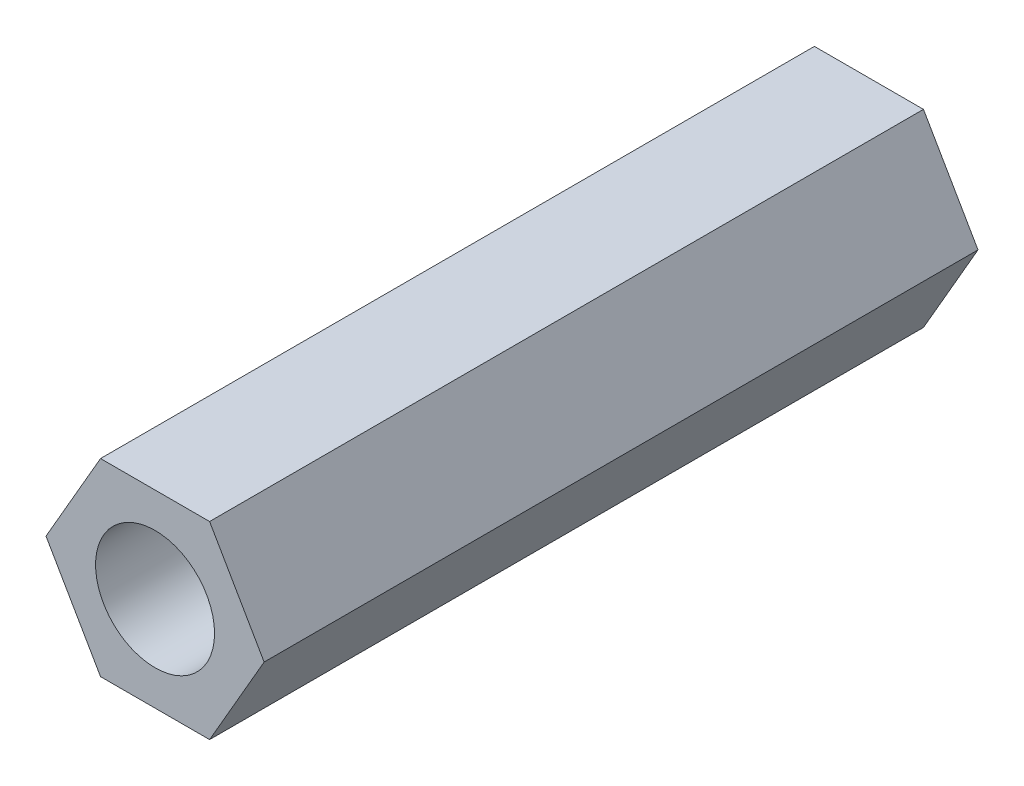
from build123d import *

# Parameters (mm, degrees)
SKETCH1_R           = 1.5
BOSS_EXTRUDE1_DEPTH = 18


with BuildPart() as part:
    # Sketch1 → Boss-Extrude1 (new body)
    with BuildSketch(Plane.XY):
        Polygon((-1.375, 2.38156986), (-2.75, 0), (-1.375, -2.38156986), (1.375, -2.38156986), (2.75, 0), (1.375, 2.38156986), align=None)
        Circle(SKETCH1_R, mode=Mode.SUBTRACT)
    extrude(amount=BOSS_EXTRUDE1_DEPTH)


solid = part.part
